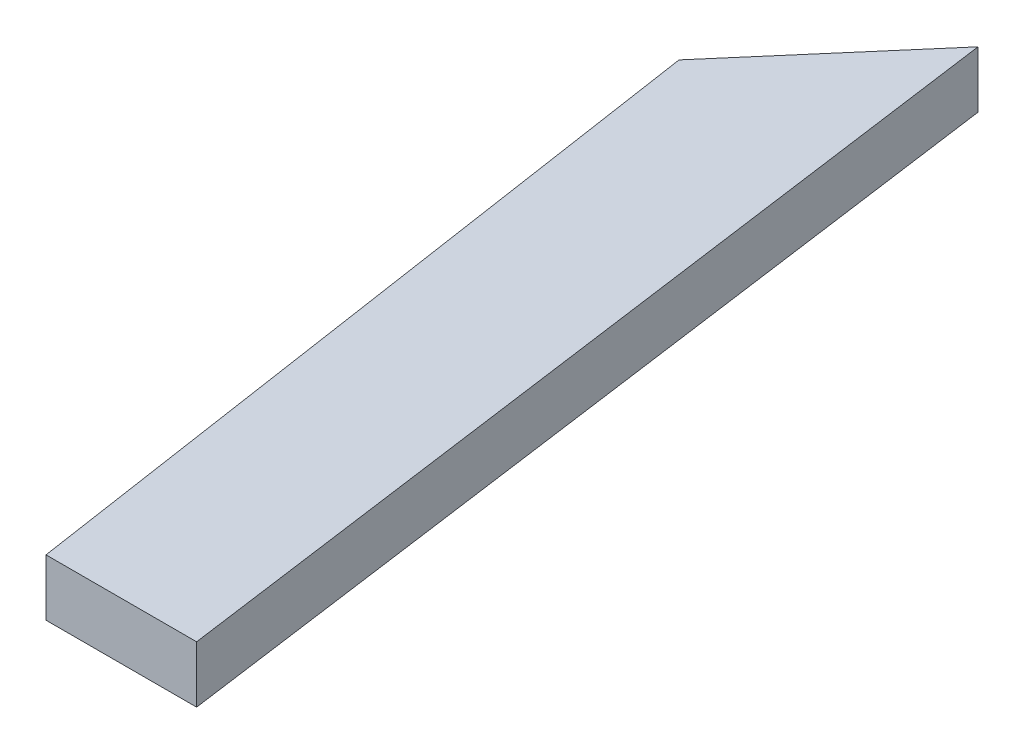
from build123d import *

# Parameters (mm, degrees)
BOSS_EXTRUDE1_DEPTH = 12.7


with BuildPart() as part:
    # Sketch1 → Boss-Extrude1 (new body)
    with BuildSketch(Plane(origin=(0, 0, 0), x_dir=(1, 0, 0), z_dir=(0, 1, 0))):
        Polygon((0, 0), (33.782, 0), (5.842, 203.2), (-25.146, 167.132), align=None)
    extrude(amount=BOSS_EXTRUDE1_DEPTH)


solid = part.part
